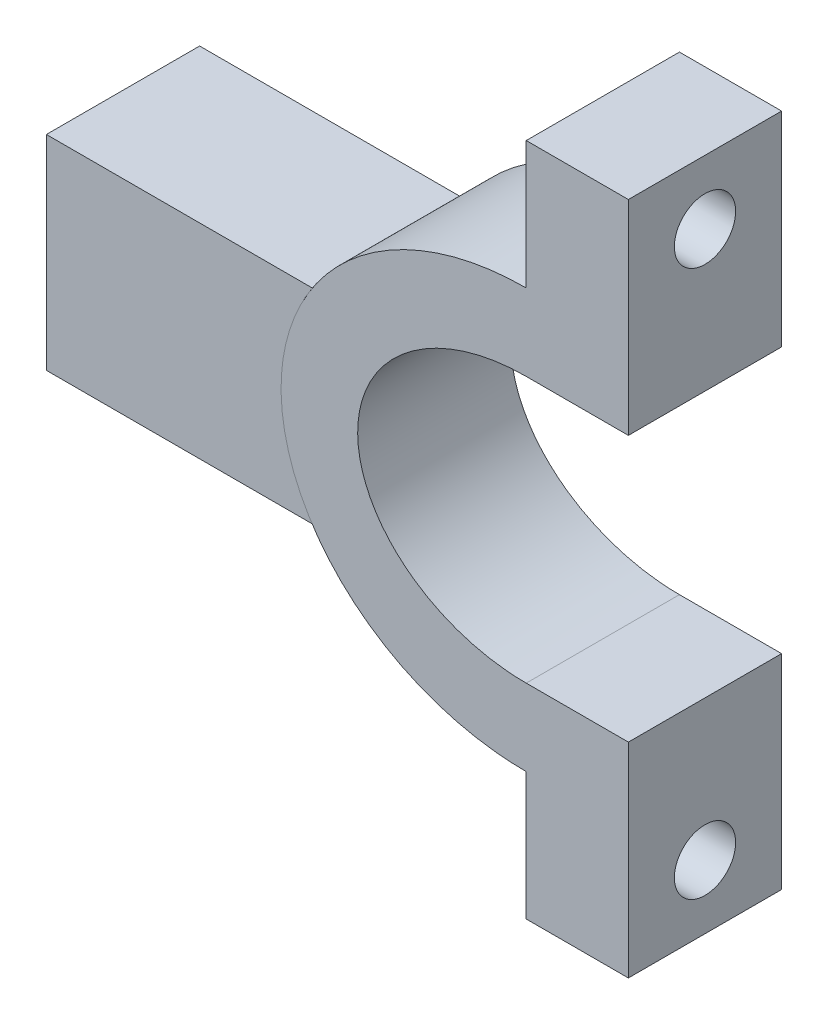
from build123d import *

# Parameters (mm, degrees)
BOSS_EXTRUDE1_DEPTH      = 15
BOSS_EXTRUDE2_DEPTH      = 5
BOSS_EXTRUDE2_DEPTH_BACK = 23
SKETCH2_W                = 15
SKETCH2_H                = 20
SKETCH3_W                = 15
SKETCH3_H                = 20
BOSS_EXTRUDE3_DEPTH      = 10
SKETCH4_R                = 3
CUT_EXTRUDE1_DEPTH       = 60.354865167


with BuildPart() as part:
    # Sketch1 → Boss-Extrude1 (new body)
    with BuildSketch(Plane.XY):
        with BuildLine():
            Line((0, 13), (0, 20.5))
            add(Edge.make_bspline(
                [(0, 20.5), (-24, 20.5), (-24, 0), (-24, -20.5), (0, -20.5)],
                knots=[1.570796327, 1.570796327, 1.570796327, 3.141592654, 3.141592654, 4.71238898, 4.71238898, 4.71238898], degree=2, weights=[1, 0.707106781, 1, 0.707106781, 1]))
            Line((0, -20.5), (0, -13))
            add(Edge.make_bspline(
                [(0, 13), (-16.5, 13), (-16.5, 0), (-16.5, -13), (0, -13)],
                knots=[1.570796327, 1.570796327, 1.570796327, 3.141592654, 3.141592654, 4.71238898, 4.71238898, 4.71238898], degree=2, weights=[1, 0.707106781, 1, 0.707106781, 1]))
        make_face()
    extrude(amount=BOSS_EXTRUDE1_DEPTH)

    # Sketch2 → Boss-Extrude2 (add, two sides: drawn at the far end of the back side and taken through both)
    with BuildSketch(Plane(origin=(-24, 0, 0), x_dir=(0, 0, -1), z_dir=(1, 0, 0)).offset(-BOSS_EXTRUDE2_DEPTH_BACK)):
        with Locations((-7.472665523, 0)):
            Rectangle(SKETCH2_W, SKETCH2_H)
    extrude(amount=BOSS_EXTRUDE2_DEPTH + BOSS_EXTRUDE2_DEPTH_BACK)

    # Sketch3 → Boss-Extrude3 (add)
    with BuildSketch(Plane(origin=(0, 0, 0), x_dir=(0, 0, -1), z_dir=(1, 0, 0))):
        with Locations((-7.5, 23)):
            Rectangle(SKETCH3_W, SKETCH3_H)
        with Locations((-7.5, -23)):
            Rectangle(SKETCH3_W, SKETCH3_H)
    extrude(amount=BOSS_EXTRUDE3_DEPTH)

    # Sketch4 → Cut-Extrude1 (cut, through all)
    with BuildSketch(Plane.ZY):
        with Locations(Location((7.5, 26.75, 0), (0, 0, 270))):
            Circle(SKETCH4_R)
        with Locations(Location((7.5, -26.75, 0), (0, 0, 90))):
            Circle(SKETCH4_R)
    extrude(amount=-CUT_EXTRUDE1_DEPTH, mode=Mode.SUBTRACT)


solid = part.part
